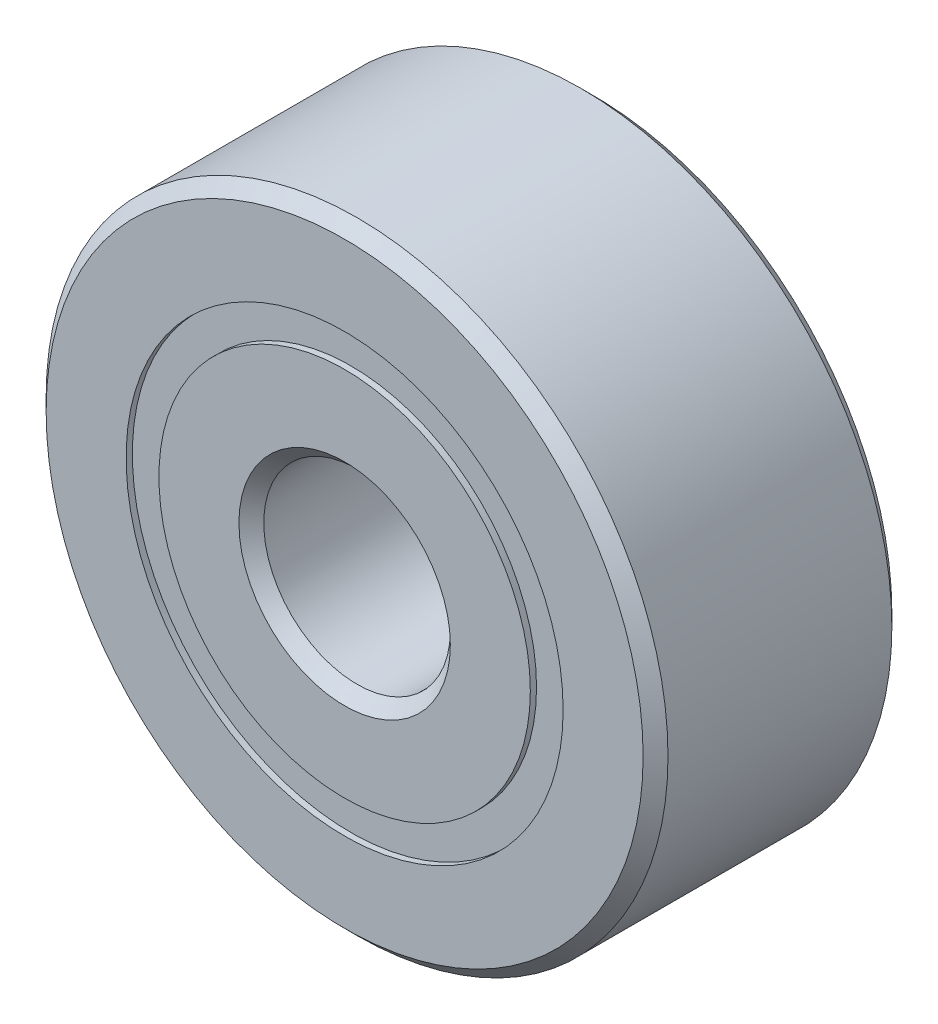
from build123d import *

# Parameters (mm, degrees)
CIRPATTERN1_COUNT = 12
SKETCH5_W         = 0.972810551
SKETCH5_H         = 0.527472528


with BuildPart() as part:
    # Sketch1 → Revolve1 (revolve)
    with BuildSketch(Plane(origin=(0, 0, 0), x_dir=(0, 0, -1), z_dir=(1, 0, 0)), mode=Mode.PRIVATE) as revolve1_sk:
        with BuildLine():
            Line((1.8, 5), (-1.8, 5))
            Line((-1.8, 5), (-2, 4.8))
            Line((-2, 4.8), (-2, 3.513736264))
            Line((-2, 3.513736264), (-0.888888889, 3.513736264))
            ThreePointArc((-0.888888889, 3.513736264), (0, 4.177189449), (0.888888889, 3.513736264))
            Line((0.888888889, 3.513736264), (2, 3.513736264))
            Line((2, 3.513736264), (2, 4.8))
            Line((2, 4.8), (1.8, 5))
        make_face()
    revolve(revolve1_sk.sketch.rotate(Axis((0, 0, 2), (0, 0, -1)), 90), axis=Axis((0, 0, 2), (0, 0, -1)))


with BuildPart() as body_2:
    # Sketch3 → Revolve3 (revolve)
    with BuildSketch(Plane(origin=(0, 0, 0), x_dir=(0, 0, -1), z_dir=(1, 0, 0)), mode=Mode.PRIVATE) as revolve3_sk:
        with BuildLine():
            Line((-2, 2.986263736), (-0.888888889, 2.986263736))
            ThreePointArc((-0.888888889, 2.986263736), (0, 2.322810551), (0.888888889, 2.986263736))
            Line((0.888888889, 2.986263736), (2, 2.986263736))
            Line((2, 2.986263736), (2, 1.7))
            Line((2, 1.7), (1.8, 1.5))
            Line((1.8, 1.5), (-1.8, 1.5))
            Line((-1.8, 1.5), (-2, 1.7))
            Line((-2, 1.7), (-2, 2.986263736))
        make_face()
    revolve(revolve3_sk.sketch.rotate(Axis((0, 0, 2), (0, 0, -1)), 90), axis=Axis((0, 0, 2), (0, 0, -1)))


with BuildPart() as body_3:
    # Sketch4 → Revolve4 (revolve)
    with BuildSketch(Plane(origin=(0, 0, 0), x_dir=(0, 0, -1), z_dir=(1, 0, 0))):
        with BuildLine():
            Line((-0.927189449, 3.25), (0.927189449, 3.25))
            ThreePointArc((0.927189449, 3.25), (0, 4.177189449), (-0.927189449, 3.25))
        make_face()
    revolve(axis=Axis((0, 3.25, 0.927189449), (0, 0, -1)))


with BuildPart() as cirpattern1_1:
    # CirPattern1: pattern copy
    add(body_3.part.rotate(Axis((0, 0, 0), (0, 0, 1)), 1 * 360 / CIRPATTERN1_COUNT))


with BuildPart() as cirpattern1_2:
    # CirPattern1: pattern copy
    add(body_3.part.rotate(Axis((0, 0, 0), (0, 0, 1)), 2 * 360 / CIRPATTERN1_COUNT))


with BuildPart() as cirpattern1_3:
    # CirPattern1: pattern copy
    add(body_3.part.rotate(Axis((0, 0, 0), (0, 0, 1)), 3 * 360 / CIRPATTERN1_COUNT))


with BuildPart() as cirpattern1_4:
    # CirPattern1: pattern copy
    add(body_3.part.rotate(Axis((0, 0, 0), (0, 0, 1)), 4 * 360 / CIRPATTERN1_COUNT))


with BuildPart() as cirpattern1_5:
    # CirPattern1: pattern copy
    add(body_3.part.rotate(Axis((0, 0, 0), (0, 0, 1)), 5 * 360 / CIRPATTERN1_COUNT))


with BuildPart() as cirpattern1_6:
    # CirPattern1: pattern copy
    add(body_3.part.rotate(Axis((0, 0, 0), (0, 0, 1)), 6 * 360 / CIRPATTERN1_COUNT))


with BuildPart() as cirpattern1_7:
    # CirPattern1: pattern copy
    add(body_3.part.rotate(Axis((0, 0, 0), (0, 0, 1)), 7 * 360 / CIRPATTERN1_COUNT))


with BuildPart() as cirpattern1_8:
    # CirPattern1: pattern copy
    add(body_3.part.rotate(Axis((0, 0, 0), (0, 0, 1)), 8 * 360 / CIRPATTERN1_COUNT))


with BuildPart() as cirpattern1_9:
    # CirPattern1: pattern copy
    add(body_3.part.rotate(Axis((0, 0, 0), (0, 0, 1)), 9 * 360 / CIRPATTERN1_COUNT))


with BuildPart() as cirpattern1_10:
    # CirPattern1: pattern copy
    add(body_3.part.rotate(Axis((0, 0, 0), (0, 0, 1)), 10 * 360 / CIRPATTERN1_COUNT))


with BuildPart() as cirpattern1_11:
    # CirPattern1: pattern copy
    add(body_3.part.rotate(Axis((0, 0, 0), (0, 0, 1)), 11 * 360 / CIRPATTERN1_COUNT))


with BuildPart() as body_15:
    # Sketch5 → Revolve5 (revolve)
    with BuildSketch(Plane(origin=(0, 0, 0), x_dir=(0, 0, -1), z_dir=(1, 0, 0)), mode=Mode.PRIVATE) as revolve5_sk:
        with Locations((-1.413594725, 3.25)):
            Rectangle(SKETCH5_W, SKETCH5_H)
        with Locations((1.413594725, 3.25)):
            Rectangle(SKETCH5_W, SKETCH5_H)
    revolve(revolve5_sk.sketch.rotate(Axis((0, 0, 2), (0, 0, -1)), 90), axis=Axis((0, 0, 2), (0, 0, -1)))


solid = Compound([part.part, body_2.part, body_3.part, cirpattern1_1.part, cirpattern1_2.part, cirpattern1_3.part, cirpattern1_4.part, cirpattern1_5.part, cirpattern1_6.part, cirpattern1_7.part, cirpattern1_8.part, cirpattern1_9.part, cirpattern1_10.part, cirpattern1_11.part, body_15.part])
